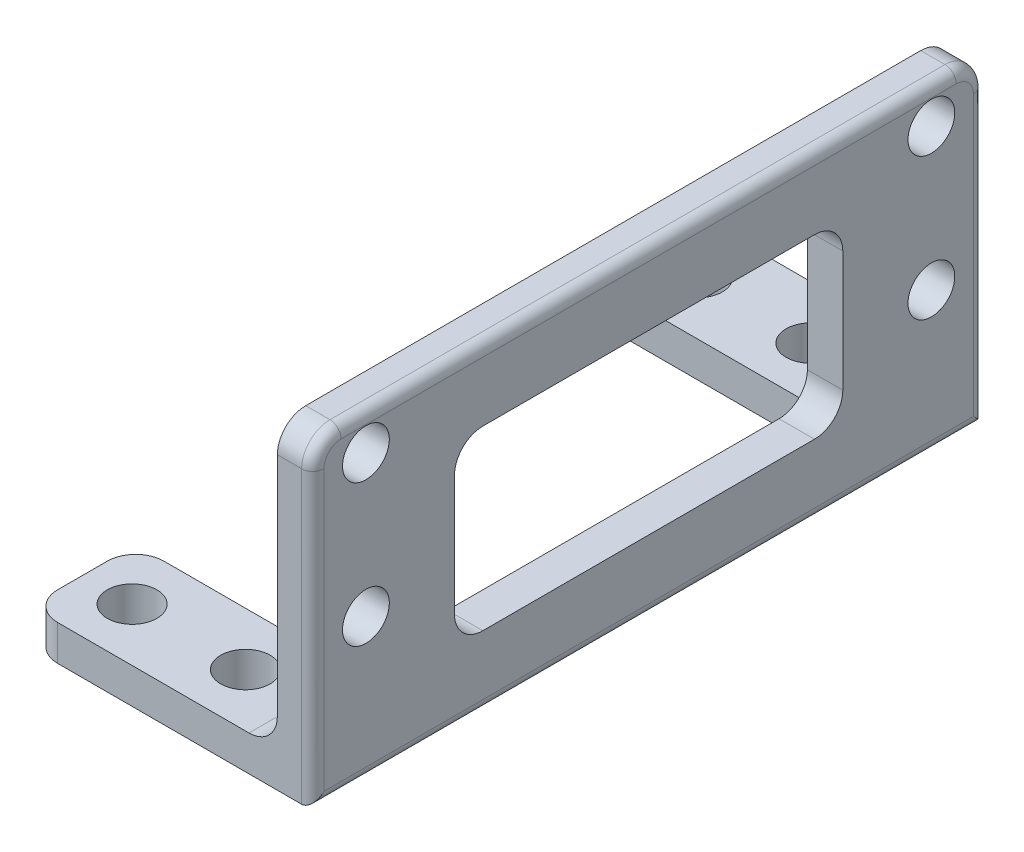
from build123d import *

# Parameters (mm, degrees)
BOSS_EXTRUDE1_DEPTH = 3.175
SKETCH2_R           = 2.2225
CUT_EXTRUDE1_DEPTH  = 57.960207911
SKETCH5_W           = 3.175
SKETCH5_H           = 60.198
BOSS_EXTRUDE3_DEPTH = 25.4
SKETCH6_R           = 2.0955
CUT_EXTRUDE3_DEPTH  = 67.208578827
SKETCH8_W           = 34.798
SKETCH8_H           = 15.875
CUT_EXTRUDE4_DEPTH  = 67.208578827
FILLET1_R           = 2.54
FILLET2_R           = 1


with BuildPart() as part:
    # Sketch1 → Boss-Extrude1 (new body)
    with BuildSketch(Plane(origin=(0, 0, 0), x_dir=(1, 0, 0), z_dir=(0, 1, 0))):
        Polygon((-12.7, -4.7625), (-12.7, 4.7625), (12.7, 4.7625), (12.7, -4.7625), (12.7, -45.9105), (12.7, -55.4355), (-12.7, -55.4355), (-12.7, -45.9105), (9.525, -45.9105), (9.525, -4.7625), align=None)
    extrude(amount=BOSS_EXTRUDE1_DEPTH)

    # Sketch2 → Cut-Extrude1 (cut, through all)
    with BuildSketch(Plane(origin=(0, 3.175, 0), x_dir=(1, 0, 0), z_dir=(0, 1, 0))):
        with Locations(Location((-8.255, 0, 0), (0, 0, 270))):
            Circle(SKETCH2_R)
        with Locations(Location((1.905, 0, 0), (0, 0, 270))):
            Circle(SKETCH2_R)
        with Locations(Location((-8.255, -50.673, 0), (0, 0, 270))):
            Circle(SKETCH2_R)
        with Locations(Location((1.905, -50.673, 0), (0, 0, 270))):
            Circle(SKETCH2_R)
    extrude(amount=-CUT_EXTRUDE1_DEPTH, mode=Mode.SUBTRACT)

    # Sketch5 → Boss-Extrude3 (add)
    with BuildSketch(Plane(origin=(0, 3.175, 0), x_dir=(1, 0, 0), z_dir=(0, 1, 0))):
        with Locations((11.1125, -25.3365)):
            Rectangle(SKETCH5_W, SKETCH5_H)
    extrude(amount=BOSS_EXTRUDE3_DEPTH)

    # Sketch6 → Cut-Extrude3 (cut, through all)
    with BuildSketch(Plane.ZY.offset(-9.525)):
        with Locations((0, 25.4)):
            Circle(SKETCH6_R)
        with Locations((0, 12.7)):
            Circle(SKETCH6_R)
        with Locations((50.673, 25.4)):
            Circle(SKETCH6_R)
        with Locations((50.673, 12.7)):
            Circle(SKETCH6_R)
    extrude(amount=-CUT_EXTRUDE3_DEPTH, mode=Mode.SUBTRACT)

    # Sketch8 → Cut-Extrude4 (cut, through all)
    with BuildSketch(Plane.ZY.offset(-9.525)):
        with Locations((25.3365, 14.2875)):
            Rectangle(SKETCH8_W, SKETCH8_H)
    extrude(amount=-CUT_EXTRUDE4_DEPTH, mode=Mode.SUBTRACT)

    # Fillet1
    fillet1_edges = [part.edges().sort_by_distance(p)[0] for p in [
        (-12.7, 1.5875, 4.7625),
        (-12.7, 1.5875, -4.7625),
        (11.1125, 28.575, -4.7625),
        (11.1125, 28.575, 55.4355),
        (-12.7, 1.5875, 55.4355),
        (-12.7, 1.5875, 45.9105),
        (9.525, 1.5875, 45.9105),
        (9.525, 1.5875, 4.7625),
        (9.525, 3.175, 0),
        (9.525, 3.175, 50.673),
        (11.1125, 6.35, 42.7355),
        (11.1125, 22.225, 42.7355),
        (11.1125, 22.225, 7.9375),
        (11.1125, 6.35, 7.9375),
    ]]
    fillet(fillet1_edges, radius=FILLET1_R)

    # Fillet2
    fillet2_edges = [part.edges().sort_by_distance(p)[0] for p in [
        (12.7, 13.0175, -4.7625),
        (12.7, 28.575, 25.3365),
        (12.7, 13.0175, 55.4355),
        (12.7, 27.831051224, 54.691551224),
        (12.7, 27.831051224, -4.018551224),
        (12.7, 0, 25.3365),
    ]]
    fillet(fillet2_edges, radius=FILLET2_R)


solid = part.part
